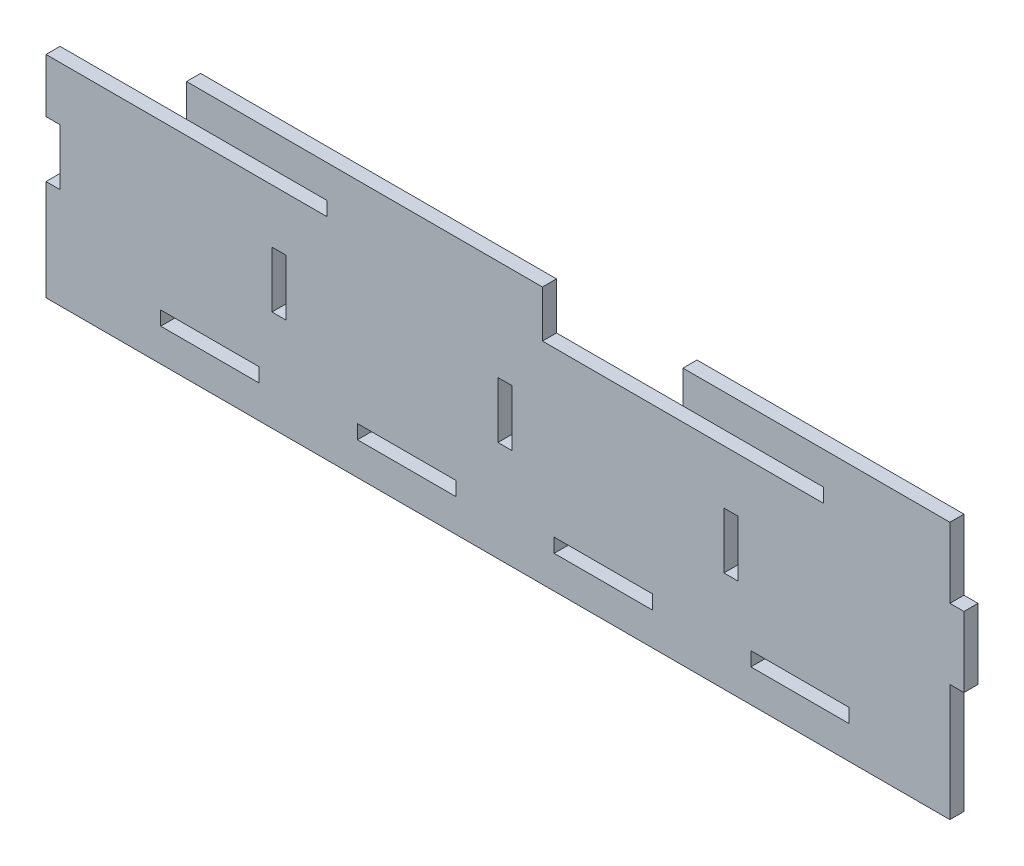
from build123d import *

# Parameters (mm, degrees)
SKETCH1_W           = 21
SKETCH1_H           = 3
SKETCH1_W_2         = 3
SKETCH1_H_2         = 12
BOSS_EXTRUDE1_DEPTH = 3


with BuildPart() as part:
    # Sketch1 → Boss-Extrude1 (new body)
    with BuildSketch(Plane.XY):
        Polygon((-99.454545455, -7.25), (-102.454545455, -7.25), (-102.454545455, -28.75), (90.545454545, -28.75), (90.545454545, -3.75), (93.545454545, -3.75), (93.545454545, 11.25), (90.545454545, 11.25), (90.545454545, 26.25), (33.545454545, 26.25), (33.545454545, 19.25), (63.545454545, 19.25), (63.545454545, 16.25), (3.545454545, 16.25), (3.545454545, 26.25), (-72.454545455, 26.25), (-72.454545455, 19.25), (-42.454545455, 19.25), (-42.454545455, 16.25), (-102.454545455, 16.25), (-102.454545455, 4.75), (-99.454545455, 4.75), align=None)
        with Locations((-67.454545455, -20.25)):
            Rectangle(SKETCH1_W, SKETCH1_H, mode=Mode.SUBTRACT)
        with Locations((-25.454545455, -20.25)):
            Rectangle(SKETCH1_W, SKETCH1_H, mode=Mode.SUBTRACT)
        with Locations((16.545454545, -20.25)):
            Rectangle(SKETCH1_W, SKETCH1_H, mode=Mode.SUBTRACT)
        with Locations((58.545454545, -20.25)):
            Rectangle(SKETCH1_W, SKETCH1_H, mode=Mode.SUBTRACT)
        with Locations((-52.704545455, -1.25)):
            Rectangle(SKETCH1_W_2, SKETCH1_H_2, mode=Mode.SUBTRACT)
        with Locations((-4.454545455, -1.25)):
            Rectangle(SKETCH1_W_2, SKETCH1_H_2, mode=Mode.SUBTRACT)
        with Locations((43.795454545, -1.25)):
            Rectangle(SKETCH1_W_2, SKETCH1_H_2, mode=Mode.SUBTRACT)
    extrude(amount=BOSS_EXTRUDE1_DEPTH)


solid = part.part
